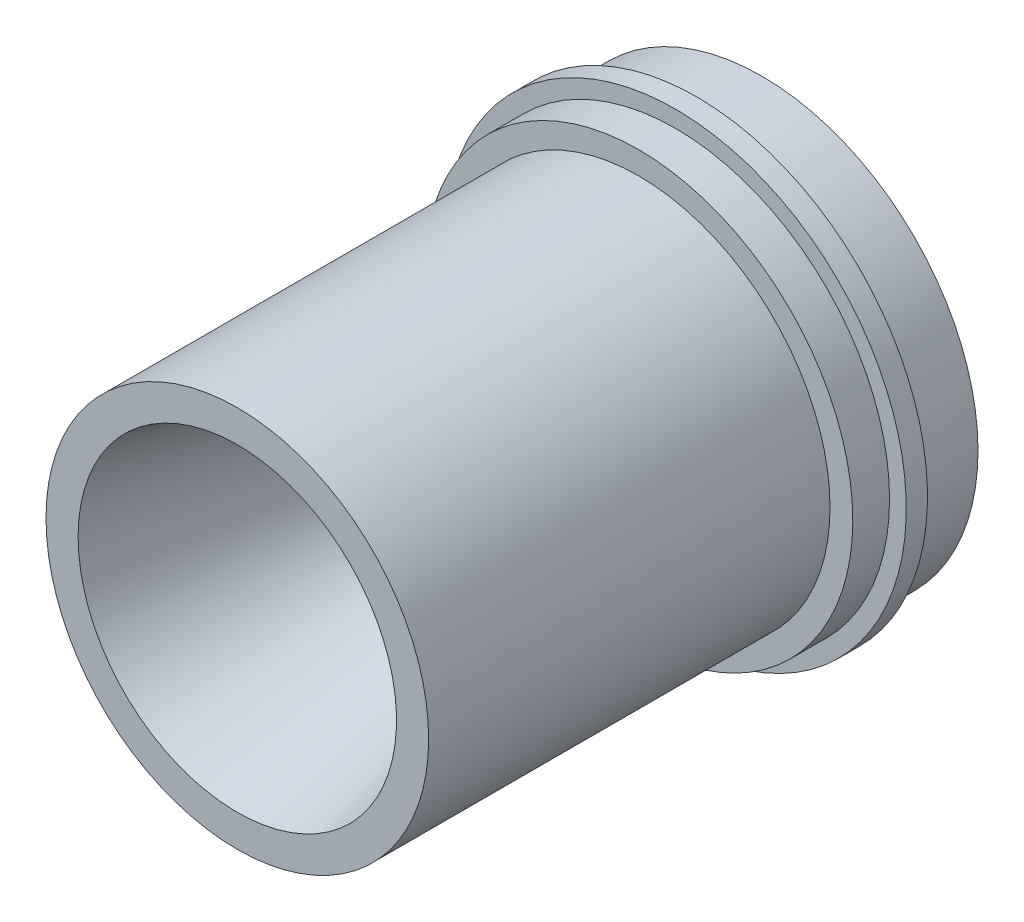
from build123d import *


with BuildPart() as part:
    # Sketch1 → Revolve4 (revolve)
    with BuildSketch(Plane(origin=(0, 0, 0), x_dir=(1, 0, 0), z_dir=(0, 1, 0)), mode=Mode.PRIVATE) as revolve4_sk:
        with BuildLine():
            add(Edge.make_bspline(
                [(9.779, 0), (14.416661489, 10.52798938), (26.83, 9.72)],
                knots=[0, 0, 0, 1, 1, 1], degree=2))
            Line((26.83, 9.72), (32.33, 9.72))
            Line((32.33, 9.72), (32.33, 0))
            Line((32.33, 0), (34.5, 0))
            Line((34.5, 0), (34.5, -3.170406434))
            Line((34.5, -3.170406434), (32, -3.170406434))
            Line((32, -3.170406434), (32, -8.670406434))
            Line((32, -8.670406434), (28.6, -8.670406434))
            Line((28.6, -8.670406434), (28.6, -68.670406434))
            Line((28.6, -68.670406434), (23.8, -68.670406434))
            Line((23.8, -68.670406434), (9.779, -13.6226))
            Line((9.779, -13.6226), (9.779, -8.8474))
            Line((9.779, -8.8474), (9.779, 0))
        make_face()
    revolve(revolve4_sk.sketch.rotate(Axis((0, 0, 0), (0, 0, 1)), 180), axis=Axis((0, 0, 0), (0, 0, 1)))


solid = part.part
